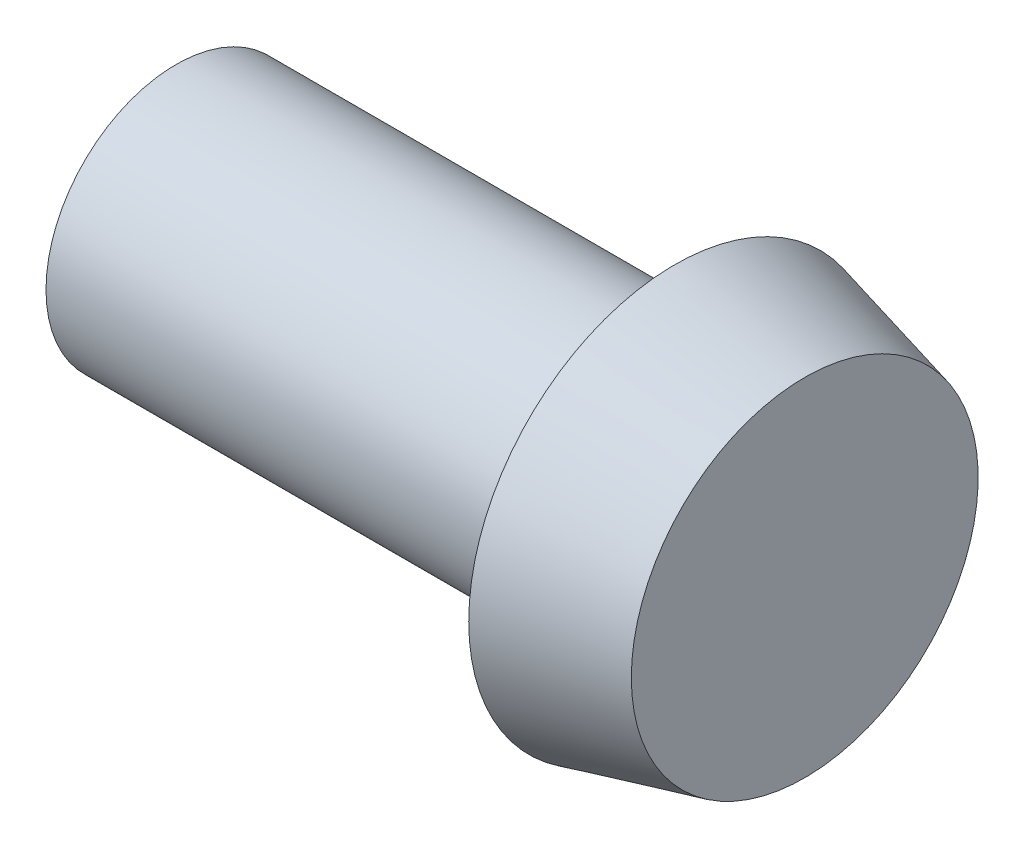
from build123d import *


with BuildPart() as part:
    # Sketch5 → Revolve2 (revolve)
    with BuildSketch(Plane(origin=(0, 0, 0), x_dir=(1, 0, 0), z_dir=(0, 1, 0)), mode=Mode.PRIVATE) as revolve2_sk:
        Polygon((0, 6), (-23, 6), (-23, 0), (6, 0), (6, 8), (0, 9.5), align=None)
    revolve(revolve2_sk.sketch.rotate(Axis((-30.464980446, 0, 0), (1, 0, 0)), 180), axis=Axis((-30.464980446, 0, 0), (1, 0, 0)))


solid = part.part
